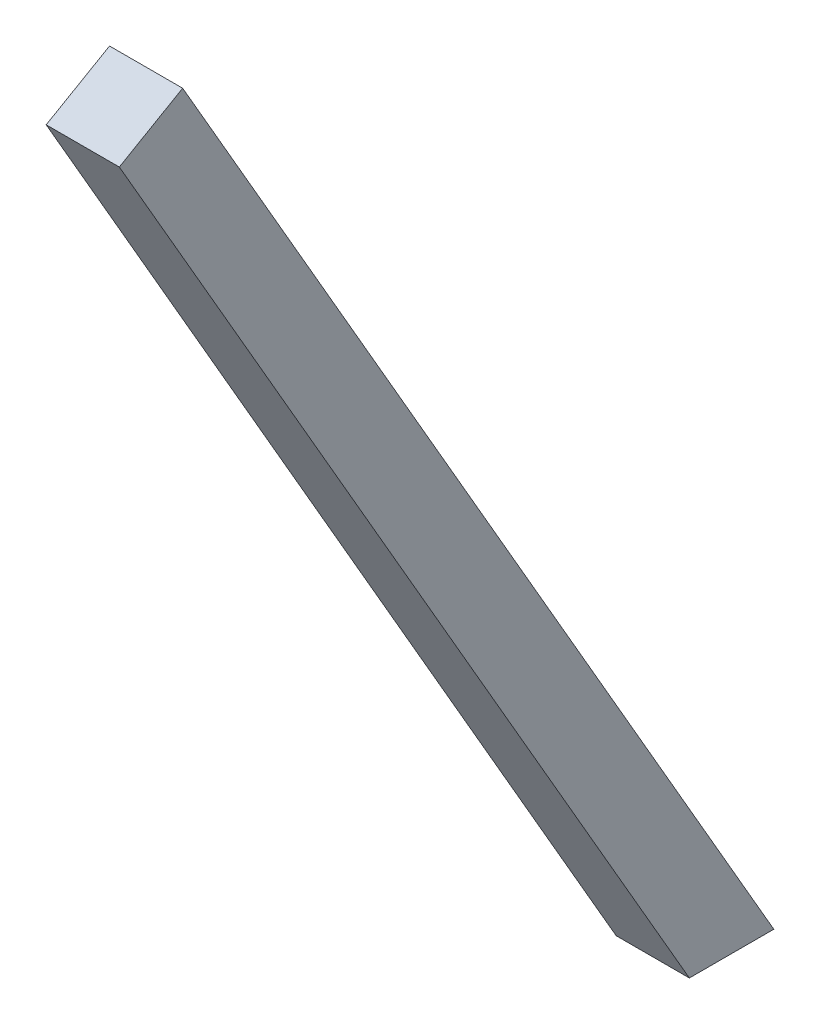
from build123d import *

# Parameters (mm, degrees)
BOSS_EXTRUDE1_DEPTH = 25.4


with BuildPart() as part:
    # Sketch2 → Boss-Extrude1 (new body)
    with BuildSketch(Plane(origin=(0, 0, 0), x_dir=(0, 0, -1), z_dir=(1, 0, 0))):
        Polygon((0, 0), (-197.973407305, 342.9), (-175.976362049, 355.6), (29.329393675, 0), align=None)
    extrude(amount=BOSS_EXTRUDE1_DEPTH)


solid = part.part
